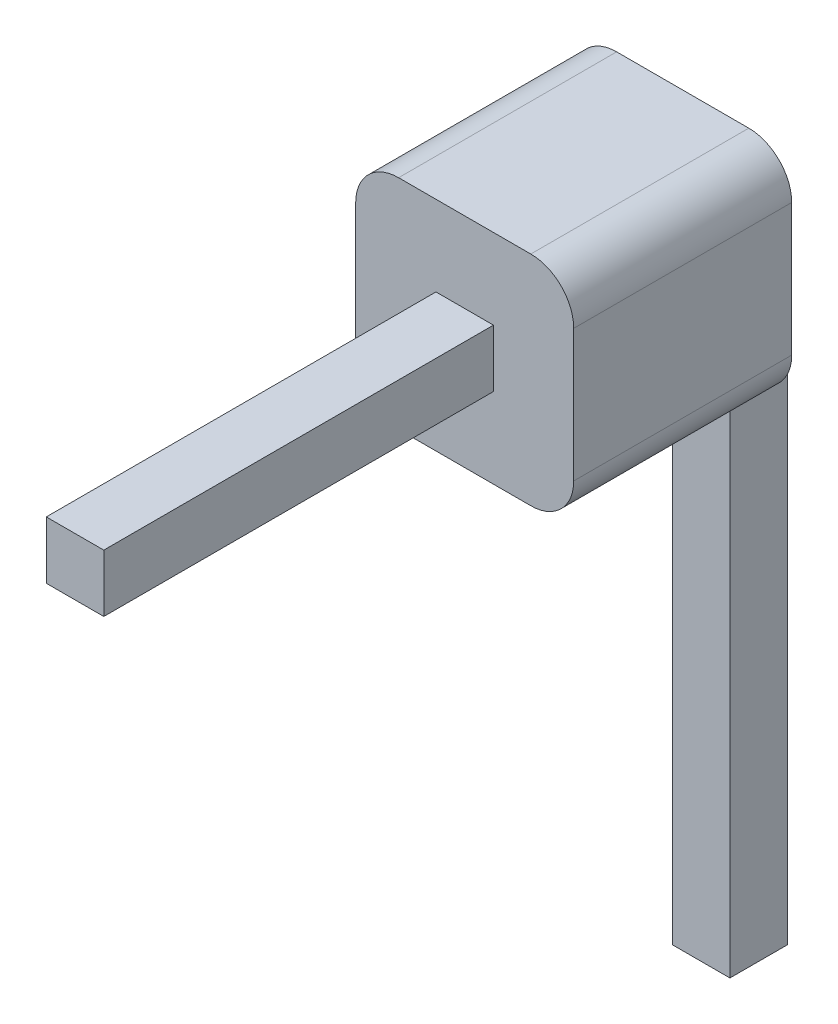
from build123d import *

# Parameters (mm, degrees)
SKETCH_1_W      = 2.54
SKETCH_1_H      = 2.54
EXTRUDE_1_DEPTH = 2.54
SKETCH_2_W      = 0.67
SKETCH_2_H      = 0.67
FILLET_1_R      = 0.5


with BuildPart() as part:
    # 草图1 → 拉伸1 (new body)
    with BuildSketch(Plane.XY):
        with Locations((0, -1.289090726)):
            Rectangle(SKETCH_1_W, SKETCH_1_H)
    extrude(amount=EXTRUDE_1_DEPTH)

    # 扫描1: sweep along a path in 草图3
    with BuildLine(Plane(origin=(0, 0, 0), x_dir=(0, 0, -1), z_dir=(1, 0, 0))) as sweep_1_path:
        Line((-7.08, -1.299090726), (-0.74, -1.299090726))
        ThreePointArc((-0.74, -1.299090726), (0.16509668, -1.673994046), (0.54, -2.579090726))
        Line((0.54, -2.579090726), (0.54, -8.919090726))
    # 草图2 → 扫描1 (sweep)
    with BuildSketch(Plane(origin=(0, 0, 7.08), x_dir=(-1, 0, 0), z_dir=(0, 0, -1))):
        with Locations((0, -1.289090726)):
            Rectangle(SKETCH_2_W, SKETCH_2_H)
    sweep(path=sweep_1_path.line)

    # 圆角1
    fillet_1_edges = [part.edges().sort_by_distance(p)[0] for p in [
        (-1.27, -0.019090726, 1.27),
        (1.27, -0.019090726, 1.27),
        (1.27, -2.559090726, 1.27),
        (-1.27, -2.559090726, 1.27),
    ]]
    fillet(fillet_1_edges, radius=FILLET_1_R)


solid = part.part
